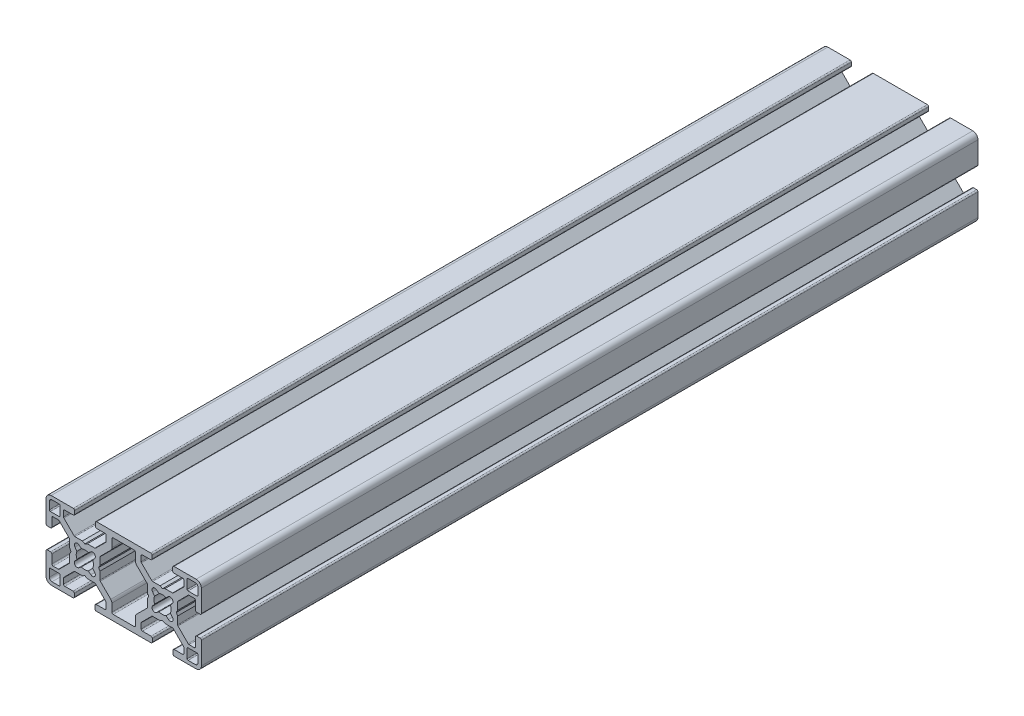
from build123d import *

# Parameters (mm, degrees)
EXTRUDE1_DEPTH = 300


with BuildPart() as part:
    # Sketch1 → Extrude1 (new body)
    with BuildSketch(Plane(origin=(0, 0, 0), x_dir=(1, 0, 0), z_dir=(0, 0, -1))):
        with BuildLine():
            Line((-25.937440125, -13.242500135), (-25.937440125, -14.49997))
            ThreePointArc((-25.937440125, -14.49997), (-25.790993516, -14.853523391), (-25.437440125, -14.99997))
            Line((-25.437440125, -14.99997), (-4.562499875, -14.99997))
            ThreePointArc((-4.562499875, -14.99997), (-4.208946484, -14.853523391), (-4.062499875, -14.49997))
            Line((-4.062499875, -14.49997), (-4.062499875, -13.242500135))
            ThreePointArc((-4.062499875, -13.242500135), (-4.208946484, -12.888946745), (-4.562499875, -12.742500135))
            Line((-4.562499875, -12.742500135), (-7.732534787, -12.742500135))
            ThreePointArc((-7.732534787, -12.742500135), (-8.097312991, -12.602474902), (-8.2499835, -12.242805721))
            Line((-8.2499835, -12.242805721), (-8.2499835, -10.260208553))
            ThreePointArc((-8.2499835, -10.260208553), (-8.211923342, -10.068867219), (-8.103537183, -9.906655869))
            Line((-8.103537183, -9.906655869), (-4.178011045, -5.981129731))
            ThreePointArc((-4.178011045, -5.981129731), (-4.015799695, -5.872743572), (-3.824458362, -5.834683414))
            Line((-3.824458362, -5.834683414), (-0.9499981, -5.834683414))
            Line((-0.9499981, -5.834683414), (0, -5.324684434))
            Line((0, -5.324684434), (0.9499981, -5.834683414))
            Line((0.9499981, -5.834683414), (3.824458362, -5.834683414))
            ThreePointArc((3.824458362, -5.834683414), (4.015799695, -5.872743572), (4.178011045, -5.981129731))
            Line((4.178011045, -5.981129731), (8.103537183, -9.906655869))
            ThreePointArc((8.103537183, -9.906655869), (8.211923342, -10.068867219), (8.2499835, -10.260208553))
            Line((8.2499835, -10.260208553), (8.2499835, -12.242805721))
            ThreePointArc((8.2499835, -12.242805721), (8.097312991, -12.602474902), (7.732534787, -12.742500135))
            Line((7.732534787, -12.742500135), (4.437500125, -12.742500135))
            ThreePointArc((4.437500125, -12.742500135), (4.083946734, -12.888946745), (3.937500125, -13.242500135))
            Line((3.937500125, -13.242500135), (3.937500125, -14.49997))
            ThreePointArc((3.937500125, -14.49997), (4.083946734, -14.853523391), (4.437500125, -14.99997))
            Line((4.437500125, -14.99997), (12.999974, -14.99997))
            ThreePointArc((12.999974, -14.99997), (14.414184734, -14.414184734), (14.99997, -12.999974))
            Line((14.99997, -12.999974), (14.99997, -4.562499875))
            ThreePointArc((14.99997, -4.562499875), (14.853523391, -4.208946484), (14.49997, -4.062499875))
            Line((14.49997, -4.062499875), (13.242500135, -4.062499875))
            ThreePointArc((13.242500135, -4.062499875), (12.888946745, -4.208946484), (12.742500135, -4.562499875))
            Line((12.742500135, -4.562499875), (12.742500135, -7.732534787))
            ThreePointArc((12.742500135, -7.732534787), (12.602474902, -8.097312991), (12.242805721, -8.2499835))
            Line((12.242805721, -8.2499835), (10.260208553, -8.2499835))
            ThreePointArc((10.260208553, -8.2499835), (10.068867219, -8.211923342), (9.906655869, -8.103537183))
            Line((9.906655869, -8.103537183), (5.981129731, -4.178011045))
            ThreePointArc((5.981129731, -4.178011045), (5.872743572, -4.015799695), (5.834683414, -3.824458362))
            Line((5.834683414, -3.824458362), (5.834683414, -1.012497975))
            Line((5.834683414, -1.012497975), (5.324684434, -0.062499875))
            Line((5.324684434, -0.062499875), (5.834683414, 0.887498225))
            Line((5.834683414, 0.887498225), (5.834683414, 3.824458362))
            ThreePointArc((5.834683414, 3.824458362), (5.872743572, 4.015799695), (5.981129731, 4.178011045))
            Line((5.981129731, 4.178011045), (9.906655869, 8.103537183))
            ThreePointArc((9.906655869, 8.103537183), (10.068867219, 8.211923342), (10.260208553, 8.2499835))
            Line((10.260208553, 8.2499835), (12.242805721, 8.2499835))
            ThreePointArc((12.242805721, 8.2499835), (12.602474902, 8.097312991), (12.742500135, 7.732534787))
            Line((12.742500135, 7.732534787), (12.742500135, 4.437500125))
            ThreePointArc((12.742500135, 4.437500125), (12.888946745, 4.083946734), (13.242500135, 3.937500125))
            Line((13.242500135, 3.937500125), (14.49997, 3.937500125))
            ThreePointArc((14.49997, 3.937500125), (14.853523391, 4.083946734), (14.99997, 4.437500125))
            Line((14.99997, 4.437500125), (14.99997, 12.999974))
            ThreePointArc((14.99997, 12.999974), (14.414184734, 14.414184734), (12.999974, 14.99997))
            Line((12.999974, 14.99997), (4.562499875, 14.99997))
            ThreePointArc((4.562499875, 14.99997), (4.208946484, 14.853523391), (4.062499875, 14.49997))
            Line((4.062499875, 14.49997), (4.062499875, 13.242500135))
            ThreePointArc((4.062499875, 13.242500135), (4.208946484, 12.888946745), (4.562499875, 12.742500135))
            Line((4.562499875, 12.742500135), (7.732534787, 12.742500135))
            ThreePointArc((7.732534787, 12.742500135), (8.097312991, 12.602474902), (8.2499835, 12.242805721))
            Line((8.2499835, 12.242805721), (8.2499835, 10.260208553))
            ThreePointArc((8.2499835, 10.260208553), (8.211923342, 10.068867219), (8.103537183, 9.906655869))
            Line((8.103537183, 9.906655869), (4.178011045, 5.981129731))
            ThreePointArc((4.178011045, 5.981129731), (4.015799695, 5.872743572), (3.824458362, 5.834683414))
            Line((3.824458362, 5.834683414), (0.9499981, 5.834683414))
            Line((0.9499981, 5.834683414), (0, 5.324684434))
            Line((0, 5.324684434), (-0.9499981, 5.834683414))
            Line((-0.9499981, 5.834683414), (-3.824458362, 5.834683414))
            ThreePointArc((-3.824458362, 5.834683414), (-4.015799695, 5.872743572), (-4.178011045, 5.981129731))
            Line((-4.178011045, 5.981129731), (-8.103537183, 9.906655869))
            ThreePointArc((-8.103537183, 9.906655869), (-8.211923342, 10.068867219), (-8.2499835, 10.260208553))
            Line((-8.2499835, 10.260208553), (-8.2499835, 12.242805721))
            ThreePointArc((-8.2499835, 12.242805721), (-8.097312991, 12.602474902), (-7.732534787, 12.742500135))
            Line((-7.732534787, 12.742500135), (-4.437500125, 12.742500135))
            ThreePointArc((-4.437500125, 12.742500135), (-4.083946734, 12.888946745), (-3.937500125, 13.242500135))
            Line((-3.937500125, 13.242500135), (-3.937500125, 14.49997))
            ThreePointArc((-3.937500125, 14.49997), (-4.083946734, 14.853523391), (-4.437500125, 14.99997))
            Line((-4.437500125, 14.99997), (-25.562439875, 14.99997))
            ThreePointArc((-25.562439875, 14.99997), (-25.915993266, 14.853523391), (-26.062439875, 14.49997))
            Line((-26.062439875, 14.49997), (-26.062439875, 13.242500135))
            ThreePointArc((-26.062439875, 13.242500135), (-25.915993266, 12.888946745), (-25.562439875, 12.742500135))
            Line((-25.562439875, 12.742500135), (-22.267405213, 12.742500135))
            ThreePointArc((-22.267405213, 12.742500135), (-21.902627009, 12.602474902), (-21.7499565, 12.242805721))
            Line((-21.7499565, 12.242805721), (-21.7499565, 10.260208553))
            ThreePointArc((-21.7499565, 10.260208553), (-21.788016658, 10.068867219), (-21.896402817, 9.906655869))
            Line((-21.896402817, 9.906655869), (-25.821928955, 5.981129731))
            ThreePointArc((-25.821928955, 5.981129731), (-25.984140305, 5.872743572), (-26.175481638, 5.834683414))
            Line((-26.175481638, 5.834683414), (-29.0499419, 5.834683414))
            Line((-29.0499419, 5.834683414), (-29.99994, 5.324684434))
            Line((-29.99994, 5.324684434), (-30.9499381, 5.834683414))
            Line((-30.9499381, 5.834683414), (-33.824398362, 5.834683414))
            ThreePointArc((-33.824398362, 5.834683414), (-34.015739695, 5.872743572), (-34.177951045, 5.981129731))
            Line((-34.177951045, 5.981129731), (-38.103477183, 9.906655869))
            ThreePointArc((-38.103477183, 9.906655869), (-38.211863342, 10.068867219), (-38.2499235, 10.260208553))
            Line((-38.2499235, 10.260208553), (-38.2499235, 12.242805721))
            ThreePointArc((-38.2499235, 12.242805721), (-38.097252991, 12.602474902), (-37.732474787, 12.742500135))
            Line((-37.732474787, 12.742500135), (-34.562439875, 12.742500135))
            ThreePointArc((-34.562439875, 12.742500135), (-34.208886484, 12.888946745), (-34.062439875, 13.242500135))
            Line((-34.062439875, 13.242500135), (-34.062439875, 14.49997))
            ThreePointArc((-34.062439875, 14.49997), (-34.208886484, 14.853523391), (-34.562439875, 14.99997))
            Line((-34.562439875, 14.99997), (-42.999914, 14.99997))
            ThreePointArc((-42.999914, 14.99997), (-44.414124734, 14.414184734), (-44.99991, 12.999974))
            Line((-44.99991, 12.999974), (-44.99991, 4.437500125))
            ThreePointArc((-44.99991, 4.437500125), (-44.853463391, 4.083946734), (-44.49991, 3.937500125))
            Line((-44.49991, 3.937500125), (-43.242440135, 3.937500125))
            ThreePointArc((-43.242440135, 3.937500125), (-42.888886745, 4.083946734), (-42.742440135, 4.437500125))
            Line((-42.742440135, 4.437500125), (-42.742440135, 7.732534787))
            ThreePointArc((-42.742440135, 7.732534787), (-42.602414902, 8.097312991), (-42.242745721, 8.2499835))
            Line((-42.242745721, 8.2499835), (-40.260148553, 8.2499835))
            ThreePointArc((-40.260148553, 8.2499835), (-40.068807219, 8.211923342), (-39.906595869, 8.103537183))
            Line((-39.906595869, 8.103537183), (-35.981069731, 4.178011045))
            ThreePointArc((-35.981069731, 4.178011045), (-35.872683572, 4.015799695), (-35.834623414, 3.824458362))
            Line((-35.834623414, 3.824458362), (-35.834623414, 0.887498225))
            Line((-35.834623414, 0.887498225), (-35.324624434, -0.062499875))
            Line((-35.324624434, -0.062499875), (-35.834623414, -1.012497975))
            Line((-35.834623414, -1.012497975), (-35.834623414, -3.824458362))
            ThreePointArc((-35.834623414, -3.824458362), (-35.872683572, -4.015799695), (-35.981069731, -4.178011045))
            Line((-35.981069731, -4.178011045), (-39.906595869, -8.103537183))
            ThreePointArc((-39.906595869, -8.103537183), (-40.068807219, -8.211923342), (-40.260148553, -8.2499835))
            Line((-40.260148553, -8.2499835), (-42.242745721, -8.2499835))
            ThreePointArc((-42.242745721, -8.2499835), (-42.602414902, -8.097312991), (-42.742440135, -7.732534787))
            Line((-42.742440135, -7.732534787), (-42.742440135, -4.562499875))
            ThreePointArc((-42.742440135, -4.562499875), (-42.888886745, -4.208946484), (-43.242440135, -4.062499875))
            Line((-43.242440135, -4.062499875), (-44.49991, -4.062499875))
            ThreePointArc((-44.49991, -4.062499875), (-44.853463391, -4.208946484), (-44.99991, -4.562499875))
            Line((-44.99991, -4.562499875), (-44.99991, -12.999974))
            ThreePointArc((-44.99991, -12.999974), (-44.414124734, -14.414184734), (-42.999914, -14.99997))
            Line((-42.999914, -14.99997), (-34.437440125, -14.99997))
            ThreePointArc((-34.437440125, -14.99997), (-34.083886734, -14.853523391), (-33.937440125, -14.49997))
            Line((-33.937440125, -14.49997), (-33.937440125, -13.242500135))
            ThreePointArc((-33.937440125, -13.242500135), (-34.083886734, -12.888946745), (-34.437440125, -12.742500135))
            Line((-34.437440125, -12.742500135), (-37.732474787, -12.742500135))
            ThreePointArc((-37.732474787, -12.742500135), (-38.097252991, -12.602474902), (-38.2499235, -12.242805721))
            Line((-38.2499235, -12.242805721), (-38.2499235, -10.260208553))
            ThreePointArc((-38.2499235, -10.260208553), (-38.211863342, -10.068867219), (-38.103477183, -9.906655869))
            Line((-38.103477183, -9.906655869), (-34.177951045, -5.981129731))
            ThreePointArc((-34.177951045, -5.981129731), (-34.015739695, -5.872743572), (-33.824398362, -5.834683414))
            Line((-33.824398362, -5.834683414), (-30.9499381, -5.834683414))
            Line((-30.9499381, -5.834683414), (-29.99994, -5.324684434))
            Line((-29.99994, -5.324684434), (-29.0499419, -5.834683414))
            Line((-29.0499419, -5.834683414), (-26.175481638, -5.834683414))
            ThreePointArc((-26.175481638, -5.834683414), (-25.984140305, -5.872743572), (-25.821928955, -5.981129731))
            Line((-25.821928955, -5.981129731), (-21.896402817, -9.906655869))
            ThreePointArc((-21.896402817, -9.906655869), (-21.788016658, -10.068867219), (-21.7499565, -10.260208553))
            Line((-21.7499565, -10.260208553), (-21.7499565, -12.242805721))
            ThreePointArc((-21.7499565, -12.242805721), (-21.902627009, -12.602474902), (-22.267405213, -12.742500135))
            Line((-22.267405213, -12.742500135), (-25.437440125, -12.742500135))
            ThreePointArc((-25.437440125, -12.742500135), (-25.790993516, -12.888946745), (-25.937440125, -13.242500135))
        make_face()
        with BuildLine():
            Line((13.318973362, 9.499981), (9.87998024, 9.499981))
            ThreePointArc((9.87998024, 9.499981), (9.611280201, 9.611280201), (9.499981, 9.87998024))
            Line((9.499981, 9.87998024), (9.499981, 13.318973362))
            ThreePointArc((9.499981, 13.318973362), (9.611573093, 13.588380507), (9.880980238, 13.6999726))
            Line((9.880980238, 13.6999726), (12.6999746, 13.6999726))
            ThreePointArc((12.6999746, 13.6999726), (13.407079967, 13.407079967), (13.6999726, 12.6999746))
            Line((13.6999726, 12.6999746), (13.6999726, 9.880980238))
            ThreePointArc((13.6999726, 9.880980238), (13.588380507, 9.611573093), (13.318973362, 9.499981))
        make_face(mode=Mode.SUBTRACT)
        with BuildLine():
            Line((13.6999726, -9.880980238), (13.6999726, -12.6999746))
            ThreePointArc((13.6999726, -12.6999746), (13.407079967, -13.407079967), (12.6999746, -13.6999726))
            Line((12.6999746, -13.6999726), (9.880980238, -13.6999726))
            ThreePointArc((9.880980238, -13.6999726), (9.611573093, -13.588380507), (9.499981, -13.318973362))
            Line((9.499981, -13.318973362), (9.499981, -9.87998024))
            ThreePointArc((9.499981, -9.87998024), (9.611280201, -9.611280201), (9.87998024, -9.499981))
            Line((9.87998024, -9.499981), (13.318973362, -9.499981))
            ThreePointArc((13.318973362, -9.499981), (13.588380507, -9.611573093), (13.6999726, -9.880980238))
        make_face(mode=Mode.SUBTRACT)
        with BuildLine():
            Line((1.339378419, 3.043295291), (2.318496952, 3.825085288))
            ThreePointArc((2.318496952, 3.825085288), (3.745385684, 3.745385684), (3.825085288, 2.318496952))
            Line((3.825085288, 2.318496952), (3.043295291, 1.339378419))
            ThreePointArc((3.043295291, 1.339378419), (3.32499335, 0), (3.043295291, -1.339378419))
            Line((3.043295291, -1.339378419), (3.825085288, -2.318496952))
            ThreePointArc((3.825085288, -2.318496952), (3.745385684, -3.745385684), (2.318496952, -3.825085288))
            Line((2.318496952, -3.825085288), (1.339378419, -3.043295291))
            ThreePointArc((1.339378419, -3.043295291), (0.005530907, -3.32498875), (-1.32924638, -3.047734378))
            Line((-1.32924638, -3.047734378), (-2.314404174, -3.834346502))
            ThreePointArc((-2.314404174, -3.834346502), (-3.741292907, -3.754646899), (-3.82099251, -2.327758166))
            Line((-3.82099251, -2.327758166), (-3.039202513, -1.348639634))
            ThreePointArc((-3.039202513, -1.348639634), (-3.324989496, -0.005062631), (-3.043295291, 1.339378419))
            Line((-3.043295291, 1.339378419), (-3.825085288, 2.318496952))
            ThreePointArc((-3.825085288, 2.318496952), (-3.745385684, 3.745385684), (-2.318496952, 3.825085288))
            Line((-2.318496952, 3.825085288), (-1.339378419, 3.043295291))
            ThreePointArc((-1.339378419, 3.043295291), (0, 3.32499335), (1.339378419, 3.043295291))
        make_face(mode=Mode.SUBTRACT)
        with BuildLine():
            Line((-10.4499791, 12.2999754), (-10.4499791, 9.268179515))
            ThreePointArc((-10.4499791, 9.268179515), (-10.335798627, 8.694155515), (-10.01064015, 8.207521465))
            Line((-10.01064015, 8.207521465), (-5.981129731, 4.178011045))
            ThreePointArc((-5.981129731, 4.178011045), (-5.872743572, 4.015799695), (-5.834683414, 3.824458362))
            Line((-5.834683414, 3.824458362), (-5.834683414, 0.887498225))
            Line((-5.834683414, 0.887498225), (-5.324684434, -0.062499875))
            Line((-5.324684434, -0.062499875), (-5.834683414, -1.012497975))
            Line((-5.834683414, -1.012497975), (-5.834683414, -3.824458362))
            ThreePointArc((-5.834683414, -3.824458362), (-5.872743572, -4.015799695), (-5.981129731, -4.178011045))
            Line((-5.981129731, -4.178011045), (-10.01064015, -8.207521465))
            ThreePointArc((-10.01064015, -8.207521465), (-10.335798627, -8.694155515), (-10.4499791, -9.268179515))
            Line((-10.4499791, -9.268179515), (-10.4499791, -12.2999754))
            ThreePointArc((-10.4499791, -12.2999754), (-10.596425417, -12.653528083), (-10.9499781, -12.7999744))
            Line((-10.9499781, -12.7999744), (-19.0499619, -12.7999744))
            ThreePointArc((-19.0499619, -12.7999744), (-19.403514583, -12.653528083), (-19.5499609, -12.2999754))
            Line((-19.5499609, -12.2999754), (-19.5499609, -9.268179515))
            ThreePointArc((-19.5499609, -9.268179515), (-19.664141373, -8.694155515), (-19.98929985, -8.207521465))
            Line((-19.98929985, -8.207521465), (-24.018810269, -4.178011045))
            ThreePointArc((-24.018810269, -4.178011045), (-24.127196428, -4.015799695), (-24.165256586, -3.824458362))
            Line((-24.165256586, -3.824458362), (-24.165256586, -1.012497975))
            Line((-24.165256586, -1.012497975), (-24.675255566, -0.062499875))
            Line((-24.675255566, -0.062499875), (-24.165256586, 0.887498225))
            Line((-24.165256586, 0.887498225), (-24.165256586, 3.824458362))
            ThreePointArc((-24.165256586, 3.824458362), (-24.127196428, 4.015799695), (-24.018810269, 4.178011045))
            Line((-24.018810269, 4.178011045), (-19.98929985, 8.207521465))
            ThreePointArc((-19.98929985, 8.207521465), (-19.664141373, 8.694155515), (-19.5499609, 9.268179515))
            Line((-19.5499609, 9.268179515), (-19.5499609, 12.2999754))
            ThreePointArc((-19.5499609, 12.2999754), (-19.403514583, 12.653528083), (-19.0499619, 12.7999744))
            Line((-19.0499619, 12.7999744), (-10.9499781, 12.7999744))
            ThreePointArc((-10.9499781, 12.7999744), (-10.596425417, 12.653528083), (-10.4499791, 12.2999754))
        make_face(mode=Mode.SUBTRACT)
        with BuildLine():
            Line((-28.660561581, 3.043295291), (-27.681443048, 3.825085288))
            ThreePointArc((-27.681443048, 3.825085288), (-26.254554316, 3.745385684), (-26.174854712, 2.318496952))
            Line((-26.174854712, 2.318496952), (-26.956644709, 1.339378419))
            ThreePointArc((-26.956644709, 1.339378419), (-26.67494665, 0), (-26.956644709, -1.339378419))
            Line((-26.956644709, -1.339378419), (-26.174854712, -2.318496952))
            ThreePointArc((-26.174854712, -2.318496952), (-26.254554316, -3.745385684), (-27.681443048, -3.825085288))
            Line((-27.681443048, -3.825085288), (-28.660561581, -3.043295291))
            ThreePointArc((-28.660561581, -3.043295291), (-29.994409093, -3.32498875), (-31.32918638, -3.047734378))
            Line((-31.32918638, -3.047734378), (-32.314344174, -3.834346502))
            ThreePointArc((-32.314344174, -3.834346502), (-33.741232907, -3.754646899), (-33.82093251, -2.327758166))
            Line((-33.82093251, -2.327758166), (-33.039142513, -1.348639634))
            ThreePointArc((-33.039142513, -1.348639634), (-33.324929496, -0.005062631), (-33.043235291, 1.339378419))
            Line((-33.043235291, 1.339378419), (-33.825025288, 2.318496952))
            ThreePointArc((-33.825025288, 2.318496952), (-33.745325684, 3.745385684), (-32.318436952, 3.825085288))
            Line((-32.318436952, 3.825085288), (-31.339318419, 3.043295291))
            ThreePointArc((-31.339318419, 3.043295291), (-29.99994, 3.32499335), (-28.660561581, 3.043295291))
        make_face(mode=Mode.SUBTRACT)
        with BuildLine():
            Line((-39.880920238, -13.6999726), (-42.6999146, -13.6999726))
            ThreePointArc((-42.6999146, -13.6999726), (-43.407019967, -13.407079967), (-43.6999126, -12.6999746))
            Line((-43.6999126, -12.6999746), (-43.6999126, -9.880980238))
            ThreePointArc((-43.6999126, -9.880980238), (-43.588320507, -9.611573093), (-43.318913362, -9.499981))
            Line((-43.318913362, -9.499981), (-39.87992024, -9.499981))
            ThreePointArc((-39.87992024, -9.499981), (-39.611220201, -9.611280201), (-39.499921, -9.87998024))
            Line((-39.499921, -9.87998024), (-39.499921, -13.318973362))
            ThreePointArc((-39.499921, -13.318973362), (-39.611513093, -13.588380507), (-39.880920238, -13.6999726))
        make_face(mode=Mode.SUBTRACT)
        with BuildLine():
            Line((-43.6999126, 9.880980238), (-43.6999126, 12.6999746))
            ThreePointArc((-43.6999126, 12.6999746), (-43.407019967, 13.407079967), (-42.6999146, 13.6999726))
            Line((-42.6999146, 13.6999726), (-39.880920238, 13.6999726))
            ThreePointArc((-39.880920238, 13.6999726), (-39.611513093, 13.588380507), (-39.499921, 13.318973362))
            Line((-39.499921, 13.318973362), (-39.499921, 9.87998024))
            ThreePointArc((-39.499921, 9.87998024), (-39.611220201, 9.611280201), (-39.87992024, 9.499981))
            Line((-39.87992024, 9.499981), (-43.318913362, 9.499981))
            ThreePointArc((-43.318913362, 9.499981), (-43.588320507, 9.611573093), (-43.6999126, 9.880980238))
        make_face(mode=Mode.SUBTRACT)
    extrude(amount=EXTRUDE1_DEPTH)


solid = part.part
